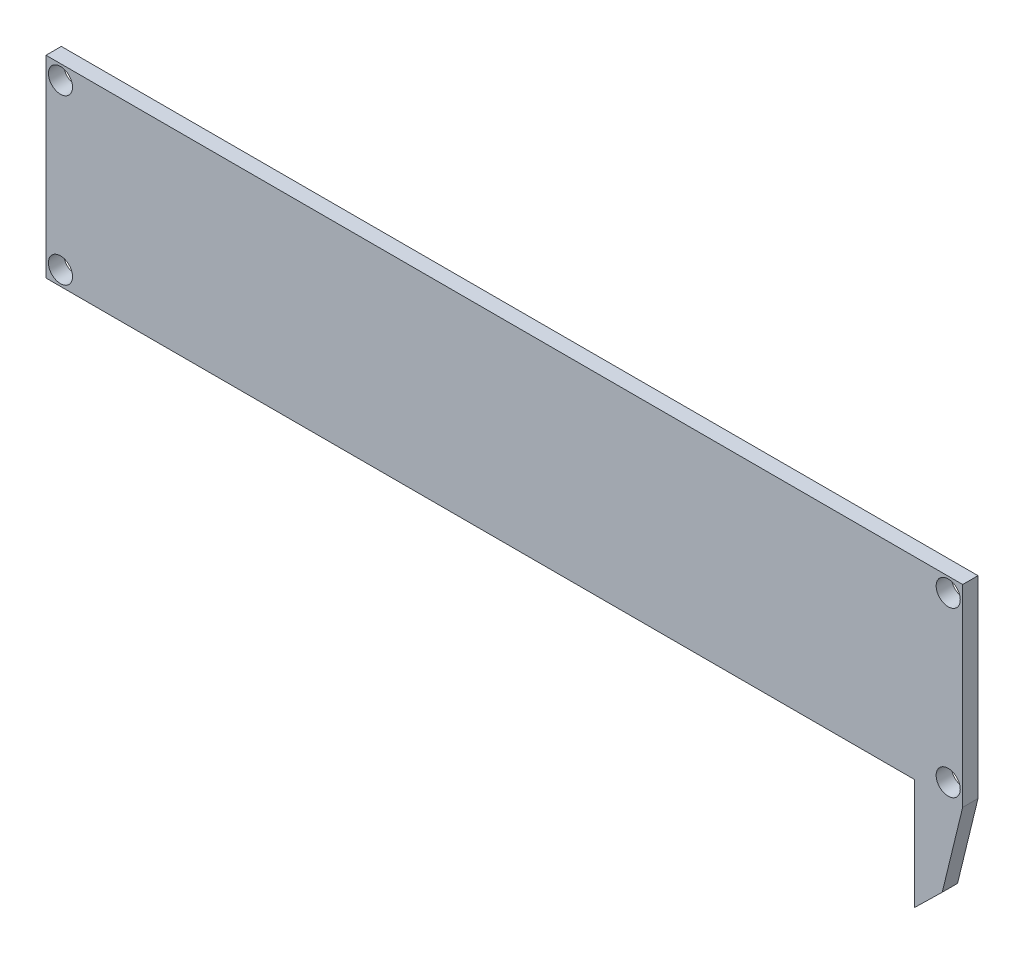
from build123d import *

# Parameters (mm, degrees)
SKETCH1_W           = 190
SKETCH1_H           = 40
BOSS_EXTRUDE1_DEPTH = 3.175
SKETCH6_R           = 2.5
CUT_EXTRUDE2_DEPTH  = 195.190835584
BOSS_EXTRUDE2_DEPTH = 3.175


with BuildPart() as part:
    # Sketch1 → Boss-Extrude1 (new body)
    with BuildSketch(Plane.XY):
        with Locations((95, 20)):
            Rectangle(SKETCH1_W, SKETCH1_H)
    extrude(amount=BOSS_EXTRUDE1_DEPTH)

    # Sketch6 → Cut-Extrude2 (cut, through all)
    with BuildSketch(Plane.XY.offset(3.175)):
        with Locations((3, 37)):
            Circle(SKETCH6_R)
        with Locations((3, 3)):
            Circle(SKETCH6_R)
        with Locations((187, 37)):
            Circle(SKETCH6_R)
        with Locations((187, 3)):
            Circle(SKETCH6_R)
    extrude(amount=-CUT_EXTRUDE2_DEPTH, mode=Mode.SUBTRACT)

    # Sketch8 → Boss-Extrude2 (add)
    with BuildSketch(Plane.XY.offset(3.175)):
        Polygon((180, -23), (185.764662443, -17.360088892), (190, 0), (180, 0), align=None)
    extrude(amount=-BOSS_EXTRUDE2_DEPTH)


solid = part.part
